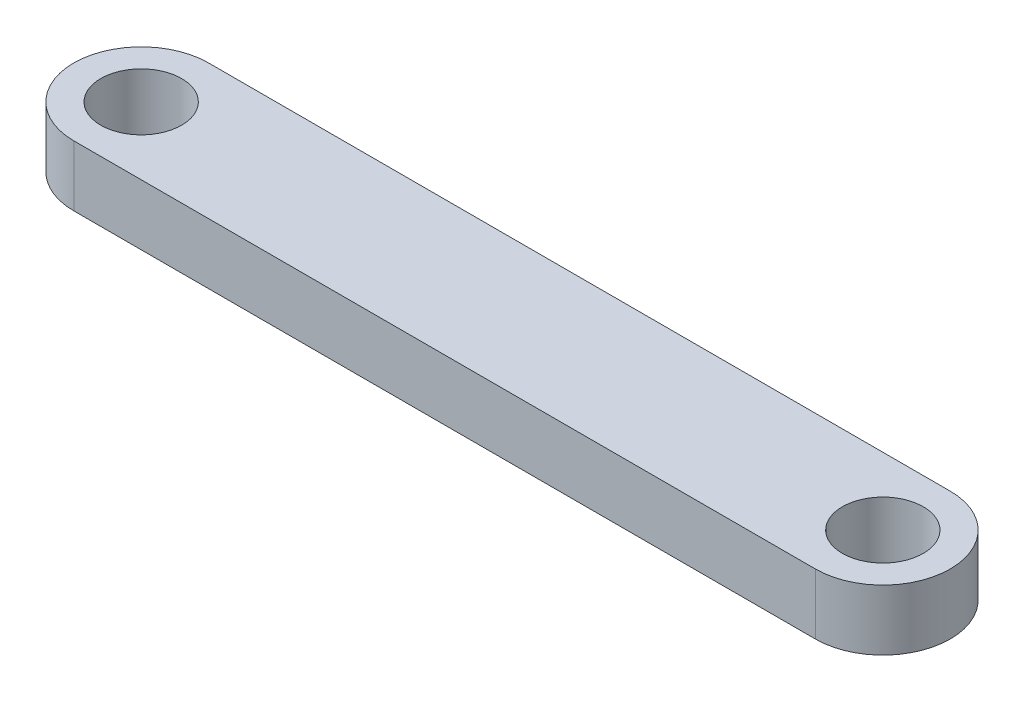
from build123d import *

# Parameters (mm, degrees)
SKETCH_1_R      = 3
EXTRUDE_1_DEPTH = 4.5


with BuildPart() as part:
    # 草图1 → 凸台-拉伸1 (new body)
    with BuildSketch(Plane(origin=(0, 0, 0), x_dir=(1, 0, 0), z_dir=(0, 1, 0))):
        with BuildLine():
            Line((-30, 5), (25, 5))
            ThreePointArc((25, 5), (30, 0), (25, -5))
            Line((25, -5), (-30, -5))
            ThreePointArc((-30, -5), (-35, 0), (-30, 5))
        make_face()
        with Locations(Location((-30, 0, 0), (0, 0, 270))):
            Circle(SKETCH_1_R, mode=Mode.SUBTRACT)
        with Locations(Location((25, 0, 0), (0, 0, 270))):
            Circle(SKETCH_1_R, mode=Mode.SUBTRACT)
    extrude(amount=EXTRUDE_1_DEPTH)


solid = part.part
